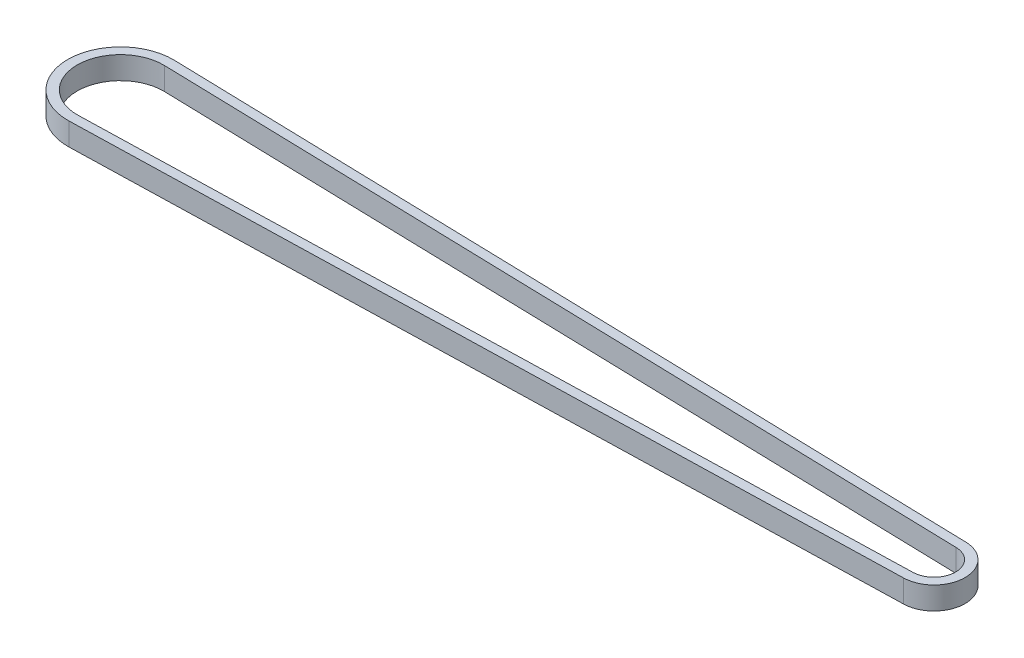
from build123d import *

# Parameters (mm, degrees)
BOSS_EXTRUDE1_DEPTH = 5.9944


with BuildPart() as part:
    # Sketch1 → Boss-Extrude1 (new body)
    with BuildSketch(Plane(origin=(0, 0, 0), x_dir=(1, 0, 0), z_dir=(0, 1, 0))):
        with BuildLine():
            Line((-107.580205882, 13.965104808), (108.168514706, 8.252107387))
            ThreePointArc((108.168514706, 8.252107387), (116.205, 0), (108.168514706, -8.252107387))
            Line((108.168514706, -8.252107387), (-107.580205882, -13.965104808))
            ThreePointArc((-107.580205882, -13.965104808), (-121.92, 0), (-107.580205882, 13.965104808))
        make_face()
        with BuildLine():
            Line((-107.646162361, 11.451369868), (108.101952504, 5.726954487))
            ThreePointArc((108.101952504, 5.726954487), (113.67897, 0), (108.101952504, -5.726954487))
            Line((108.101952504, -5.726954487), (-107.646162361, -11.451369868))
            ThreePointArc((-107.646162361, -11.451369868), (-119.4054, 0), (-107.646162361, 11.451369868))
        make_face(mode=Mode.SUBTRACT)
    extrude(amount=BOSS_EXTRUDE1_DEPTH)


solid = part.part
